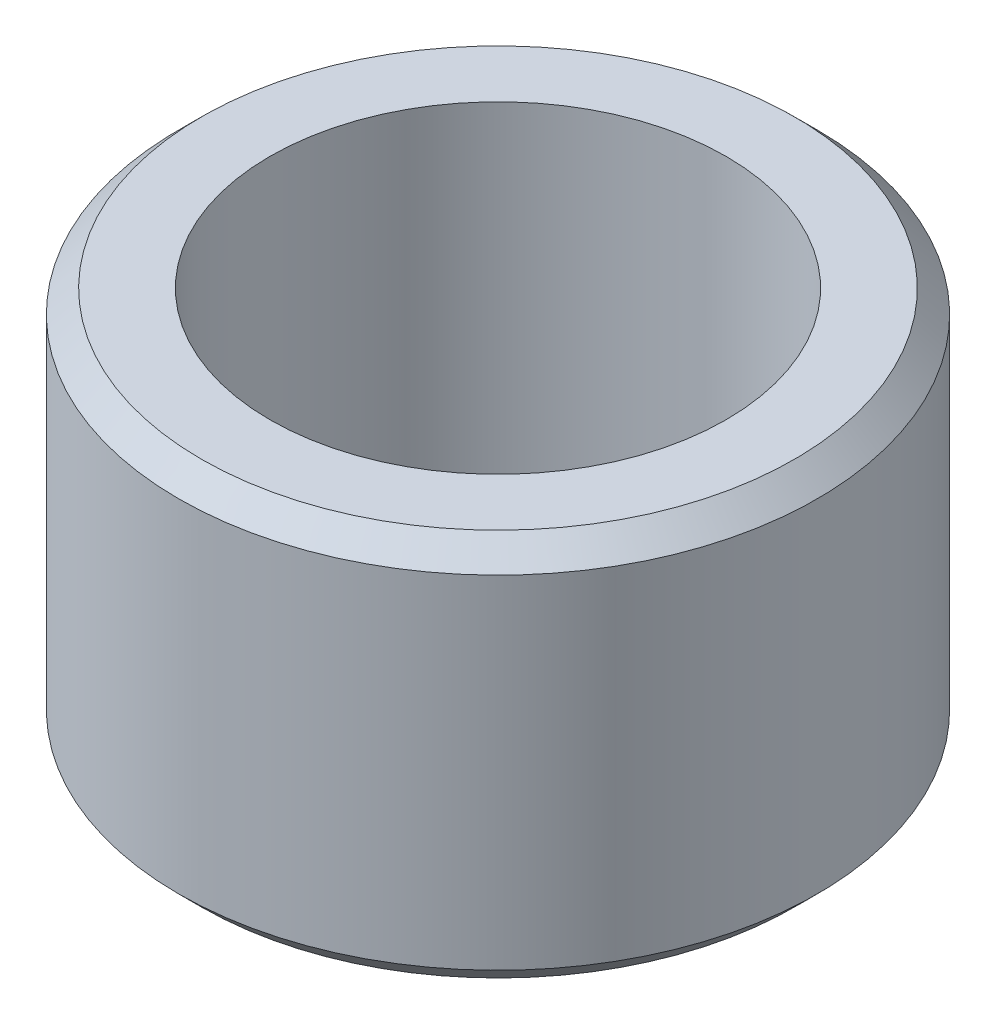
from build123d import *

# Parameters (mm, degrees)
SKETCH_1_R      = 7
SKETCH_1_R_2    = 5
EXTRUDE_1_DEPTH = 4.25
CHAMFER_1_SIZE  = 0.5


with BuildPart() as part:
    # 草图1 → 凸台-拉伸1 (new, symmetric)
    with BuildSketch(Plane(origin=(0, 0, 0), x_dir=(1, 0, 0), z_dir=(0, 1, 0))):
        with Locations(Location((0, 0, 0), (0, 0, 270))):
            Circle(SKETCH_1_R)
        with Locations(Location((0, 0, 0), (0, 0, 270))):
            Circle(SKETCH_1_R_2, mode=Mode.SUBTRACT)
    extrude(amount=EXTRUDE_1_DEPTH, both=True)

    # 倒角1
    chamfer_1_edges = [part.edges().sort_by_distance(p)[0] for p in [
        (0, -4.25, -7),
        (0, 4.25, -7),
    ]]
    chamfer(chamfer_1_edges, length=CHAMFER_1_SIZE)


solid = part.part
